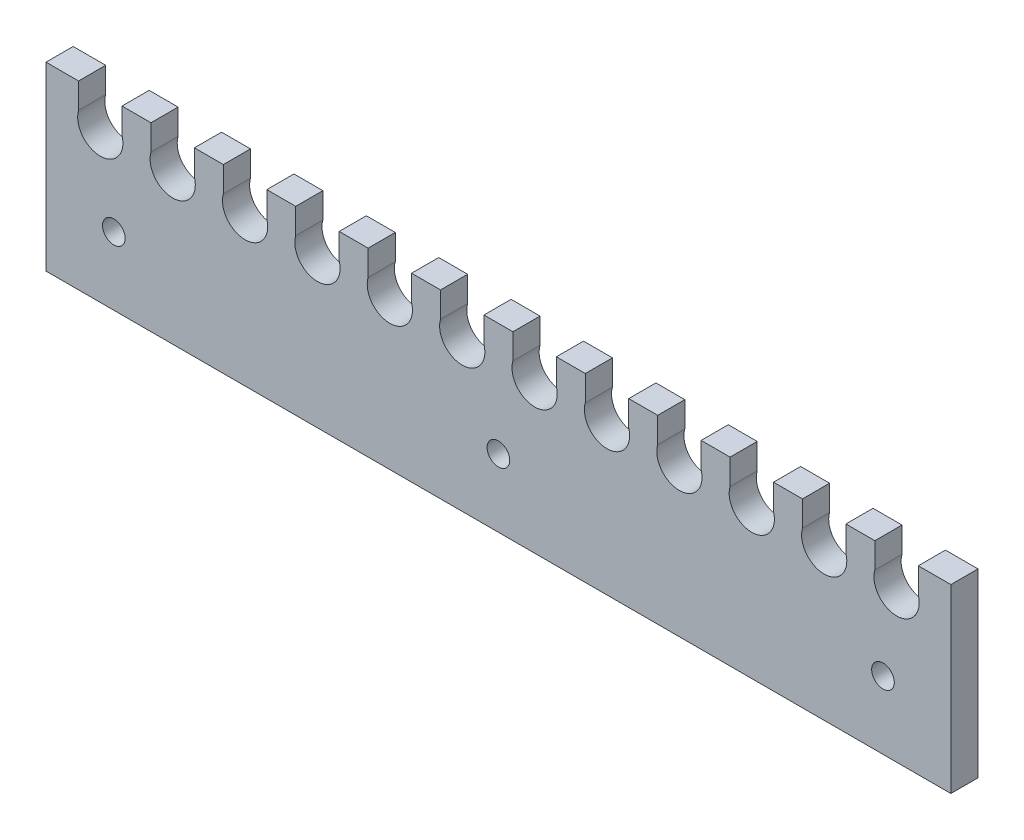
from build123d import *

# Parameters (mm, degrees)
ESQUISSE1_W                = 200
ESQUISSE1_H                = 40
BOSS_EXTRU_1_DEPTH         = 6
ENL_V_MAT_EXTRU_1_DEPTH    = 103.156742313
ESQUISSE3_R                = 2.5
ENL_V_MAT_EXTRU_2_DEPTH    = 103.156742313
R_P_TITION_LIN_AIRE1_COUNT = 12
R_P_TITION_LIN_AIRE1_PITCH = 16


with BuildPart() as part:
    # Esquisse1 → Boss.-Extru.1 (new body)
    with BuildSketch(Plane.XY):
        Rectangle(ESQUISSE1_W, ESQUISSE1_H)
    extrude(amount=BOSS_EXTRU_1_DEPTH)

    # Esquisse2 → Enlèv. mat.-Extru.1 (cut, through all)
    with BuildSketch(Plane.XY.offset(6)):
        with BuildLine():
            Line((-92.8, 14.4), (-92.8, 20))
            Line((-92.8, 20), (-83.2, 20))
            Line((-83.2, 20), (-83.2, 14.4))
            ThreePointArc((-83.2, 14.4), (-88, 8), (-92.8, 14.4))
        make_face()
    enl_v_mat_extru_1 = extrude(amount=-ENL_V_MAT_EXTRU_1_DEPTH, mode=Mode.SUBTRACT)

    # Esquisse3 → Enlèv. mat.-Extru.2 (cut, through all)
    with BuildSketch(Plane.XY.offset(6)):
        with Locations((-85, -5)):
            Circle(ESQUISSE3_R)
        with Locations((85, -5)):
            Circle(ESQUISSE3_R)
        with Locations((0, -5)):
            Circle(ESQUISSE3_R)
    extrude(amount=-ENL_V_MAT_EXTRU_2_DEPTH, mode=Mode.SUBTRACT)

    # Répétition linéaire1: Enlèv. mat.-Extru.1 ×12
    with Locations(*[(i * R_P_TITION_LIN_AIRE1_PITCH, 0, 0) for i in range(1, R_P_TITION_LIN_AIRE1_COUNT)]):
        add(enl_v_mat_extru_1, mode=Mode.SUBTRACT)


solid = part.part
